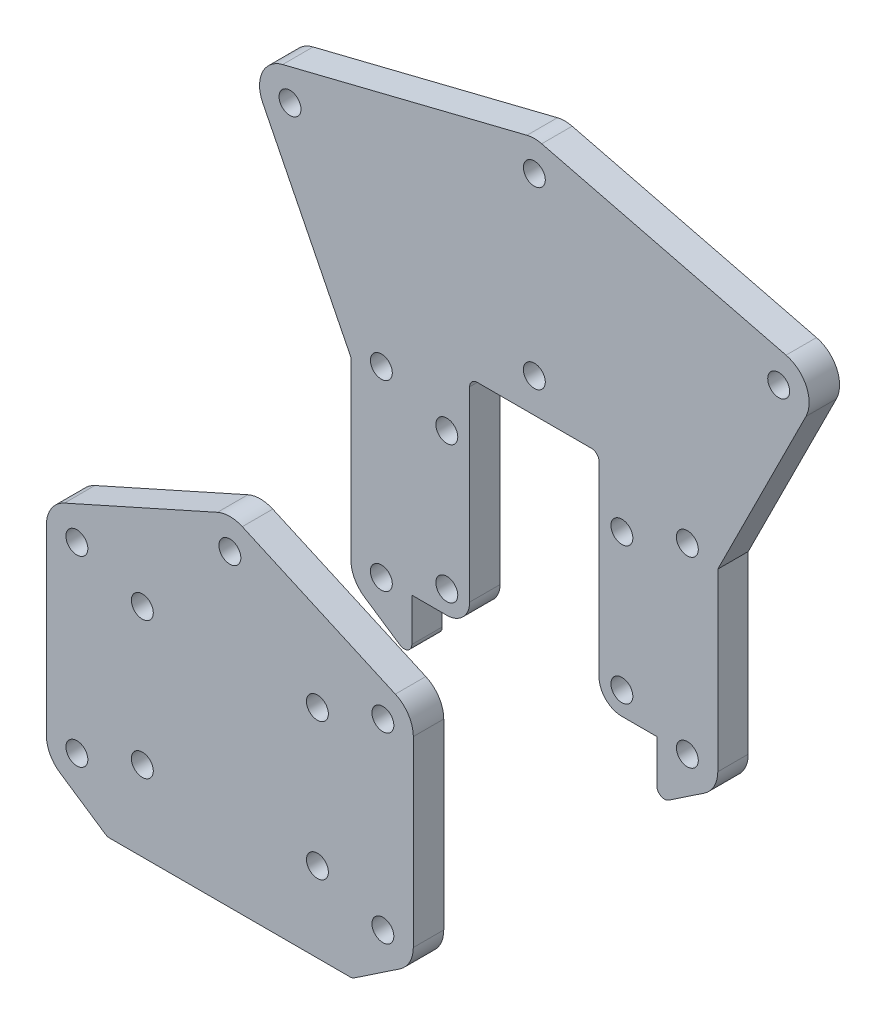
from build123d import *

# Parameters (mm, degrees)
SKETCH1_R               = 2.286
BOSS_EXTRUDE1_DEPTH     = 6.35
BOSS_EXTRUDE2_START     = -57.15
SKETCH1_3_R             = 2.286
BOSS_EXTRUDE2_DEPTH     = 6.35
FILLET1_R               = 1.5875
FILLET2_R               = 1.5875
CUT_EXTRUDE1_DEPTH      = 7.62
FILLET3_R               = 4.7625
CUT_EXTRUDE2_START      = -9.525
SKETCH4_R               = 2.286
CUT_EXTRUDE2_DEPTH      = 9.525
CUT_EXTRUDE3_DEPTH      = 119.193719489
CUT_EXTRUDE3_DEPTH_BACK = 119.193719489
SKETCH4_3_R             = 2.286


with BuildPart() as part:
    # Sketch1 → Boss-Extrude1 (new body)
    with BuildSketch(Plane.XY):
        with BuildLine():
            Line((-25.55875, -30.95625), (25.55875, -30.95625))
            Line((25.55875, -30.95625), (35.446293253, -24.323356401))
            ThreePointArc((35.446293253, -24.323356401), (37.511691176, -22.038235294), (38.25875, -19.05))
            Line((38.25875, -19.05), (38.25875, 17.550968343))
            Line((38.25875, 17.550968343), (56.638362663, 54.310193669))
            ThreePointArc((56.638362663, 54.310193669), (56.726833867, 59.805505319), (52.49433438, 63.311532327))
            Line((52.49433438, 63.311532327), (1.53558438, 76.011532327))
            ThreePointArc((1.53558438, 76.011532327), (0, 76.2), (-1.53558438, 76.011532327))
            Line((-1.53558438, 76.011532327), (-52.49433438, 63.311532327))
            ThreePointArc((-52.49433438, 63.311532327), (-56.726833867, 59.805505319), (-56.638362663, 54.310193669))
            Line((-56.638362663, 54.310193669), (-38.25875, 17.550968343))
            Line((-38.25875, 17.550968343), (-38.25875, -19.05))
            ThreePointArc((-38.25875, -19.05), (-37.511691176, -22.038235294), (-35.446293253, -24.323356401))
            Line((-35.446293253, -24.323356401), (-25.55875, -30.95625))
        make_face()
        with Locations((-31.90875, -19.05)):
            Circle(SKETCH1_R, mode=Mode.SUBTRACT)
        with Locations((-18.25625, -14.2875)):
            Circle(SKETCH1_R, mode=Mode.SUBTRACT)
        with Locations((18.25625, -14.2875)):
            Circle(SKETCH1_R, mode=Mode.SUBTRACT)
        with Locations((31.90875, -19.05)):
            Circle(SKETCH1_R, mode=Mode.SUBTRACT)
        with Locations((-31.90875, 19.05)):
            Circle(SKETCH1_R, mode=Mode.SUBTRACT)
        with Locations((-50.95875, 57.15)):
            Circle(SKETCH1_R, mode=Mode.SUBTRACT)
        with Locations((31.90875, 19.05)):
            Circle(SKETCH1_R, mode=Mode.SUBTRACT)
        with Locations((50.95875, 57.15)):
            Circle(SKETCH1_R, mode=Mode.SUBTRACT)
        with Locations((0, 69.85)):
            Circle(SKETCH1_R, mode=Mode.SUBTRACT)
    extrude(amount=BOSS_EXTRUDE1_DEPTH)

    # Fillet2
    fillet2_edges = [part.edges().sort_by_distance(p)[0] for p in [
        (25.55875, -30.95625, 3.175),
        (-25.55875, -30.95625, 3.175),
    ]]
    fillet(fillet2_edges, radius=FILLET2_R)

    # Sketch4 → Cut-Extrude2 (cut)
    # profile 1 of 3: a face of its own
    with BuildSketch(Plane.XY.offset(6.35).offset(CUT_EXTRUDE2_START)):
        with BuildLine():
            Line((-98.245897659, 9.07752692), (-38.25875, 17.550968343))
            Line((-38.25875, 17.550968343), (-56.638362663, 54.310193669))
            ThreePointArc((-56.638362663, 54.310193669), (-56.726833867, 59.805505319), (-52.49433438, 63.311532327))
            Line((-52.49433438, 63.311532327), (-1.53558438, 76.011532327))
            ThreePointArc((-1.53558438, 76.011532327), (0, 76.2), (1.53558438, 76.011532327))
            Line((1.53558438, 76.011532327), (52.49433438, 63.311532327))
            ThreePointArc((52.49433438, 63.311532327), (56.726833867, 59.805505319), (56.638362663, 54.310193669))
            Line((56.638362663, 54.310193669), (38.25875, 17.550968343))
            Line((38.25875, 17.550968343), (125.422392006, 90.402311249))
            Line((125.422392006, 90.402311249), (-79.231707288, 82.909223574))
            Line((-79.231707288, 82.909223574), (-98.245897659, 9.07752692))
        make_face()
    # profile 2 of 3: a face of its own
    with BuildSketch(Plane.XY.offset(6.35).offset(CUT_EXTRUDE2_START)):
        with Locations((0, 33.3375)):
            Circle(SKETCH4_R)
    # profile 3 of 3: a face of its own
    with BuildSketch(Plane.XY.offset(6.35).offset(CUT_EXTRUDE2_START)):
        with BuildLine():
            ThreePointArc((-38.25875, 19.05), (-37.237956498, 22.502833345), (-34.503771069, 24.845547054))
            Line((-34.503771069, 24.845547054), (-2.595021069, 39.133047054))
            ThreePointArc((-2.595021069, 39.133047054), (0, 39.6875), (2.595021069, 39.133047054))
            Line((2.595021069, 39.133047054), (34.503771069, 24.845547054))
            ThreePointArc((34.503771069, 24.845547054), (37.237956498, 22.502833345), (38.25875, 19.05))
            Line((38.25875, 19.05), (38.25875, 17.550968343))
            Line((38.25875, 17.550968343), (56.638362663, 54.310193669))
            ThreePointArc((56.638362663, 54.310193669), (56.726833867, 59.805505319), (52.49433438, 63.311532327))
            Line((52.49433438, 63.311532327), (1.53558438, 76.011532327))
            ThreePointArc((1.53558438, 76.011532327), (0, 76.2), (-1.53558438, 76.011532327))
            Line((-1.53558438, 76.011532327), (-52.49433438, 63.311532327))
            ThreePointArc((-52.49433438, 63.311532327), (-56.726833867, 59.805505319), (-56.638362663, 54.310193669))
            Line((-56.638362663, 54.310193669), (-38.25875, 17.550968343))
            Line((-38.25875, 17.550968343), (-38.25875, 19.05))
        make_face()
        with Locations(Location((-50.95875, 57.15, 0), (0, 0, 270))):
            Circle(SKETCH4_R, mode=Mode.SUBTRACT)
        with Locations(Location((0, 69.85, 0), (0, 0, 270))):
            Circle(SKETCH4_R, mode=Mode.SUBTRACT)
        with Locations(Location((50.95875, 57.15, 0), (0, 0, 270))):
            Circle(SKETCH4_R, mode=Mode.SUBTRACT)
    extrude(amount=CUT_EXTRUDE2_DEPTH, mode=Mode.SUBTRACT)


with BuildPart() as body_2:
    # Sketch1<3> → Boss-Extrude2 (new body)
    with BuildSketch(Plane.XY.offset(BOSS_EXTRUDE2_START)):
        with BuildLine():
            Line((-25.55875, -19.05), (25.55875, -19.05))
            Line((25.55875, -19.05), (25.55875, -30.95625))
            Line((25.55875, -30.95625), (35.446293253, -24.323356401))
            ThreePointArc((35.446293253, -24.323356401), (37.511691176, -22.038235294), (38.25875, -19.05))
            Line((38.25875, -19.05), (38.25875, 17.550968343))
            Line((38.25875, 17.550968343), (56.638362663, 54.310193669))
            ThreePointArc((56.638362663, 54.310193669), (56.726833867, 59.805505319), (52.49433438, 63.311532327))
            Line((52.49433438, 63.311532327), (1.53558438, 76.011532327))
            ThreePointArc((1.53558438, 76.011532327), (0, 76.2), (-1.53558438, 76.011532327))
            Line((-1.53558438, 76.011532327), (-52.49433438, 63.311532327))
            ThreePointArc((-52.49433438, 63.311532327), (-56.726833867, 59.805505319), (-56.638362663, 54.310193669))
            Line((-56.638362663, 54.310193669), (-38.25875, 17.550968343))
            Line((-38.25875, 17.550968343), (-38.25875, -19.05))
            ThreePointArc((-38.25875, -19.05), (-37.511691176, -22.038235294), (-35.446293253, -24.323356401))
            Line((-35.446293253, -24.323356401), (-25.55875, -30.95625))
            Line((-25.55875, -30.95625), (-25.55875, -19.05))
        make_face()
        with Locations(Location((-31.90875, -19.05, 0), (0, 0, 270))):
            Circle(SKETCH1_3_R, mode=Mode.SUBTRACT)
        with Locations(Location((-18.25625, -14.2875, 0), (0, 0, 270))):
            Circle(SKETCH1_3_R, mode=Mode.SUBTRACT)
        with Locations(Location((18.25625, -14.2875, 0), (0, 0, 270))):
            Circle(SKETCH1_3_R, mode=Mode.SUBTRACT)
        with Locations(Location((31.90875, -19.05, 0), (0, 0, 270))):
            Circle(SKETCH1_3_R, mode=Mode.SUBTRACT)
        with Locations(Location((-31.90875, 19.05, 0), (0, 0, 270))):
            Circle(SKETCH1_3_R, mode=Mode.SUBTRACT)
        with Locations(Location((-50.95875, 57.15, 0), (0, 0, 270))):
            Circle(SKETCH1_3_R, mode=Mode.SUBTRACT)
        with Locations(Location((31.90875, 19.05, 0), (0, 0, 270))):
            Circle(SKETCH1_3_R, mode=Mode.SUBTRACT)
        with Locations(Location((50.95875, 57.15, 0), (0, 0, 270))):
            Circle(SKETCH1_3_R, mode=Mode.SUBTRACT)
        with Locations(Location((0, 69.85, 0), (0, 0, 270))):
            Circle(SKETCH1_3_R, mode=Mode.SUBTRACT)
    extrude(amount=-BOSS_EXTRUDE2_DEPTH)

    # Fillet1
    fillet1_edges = [body_2.edges().sort_by_distance(p)[0] for p in [
        (-25.55875, -30.95625, -60.325),
        (25.55875, -30.95625, -60.325),
    ]]
    fillet(fillet1_edges, radius=FILLET1_R)

    # Sketch3 → Cut-Extrude1 (cut)
    with BuildSketch(Plane(origin=(0, 0, -63.5), x_dir=(-1, 0, 0), z_dir=(0, 0, -1))):
        with BuildLine():
            Line((11.90625, 26.19375), (-11.90625, 26.19375))
            ThreePointArc((-11.90625, 26.19375), (-13.028782015, 25.728782015), (-13.49375, 24.60625))
            Line((-13.49375, 24.60625), (-13.49375, -24.60625))
            ThreePointArc((-13.49375, -24.60625), (-13.028782015, -25.728782015), (-11.90625, -26.19375))
            Line((-11.90625, -26.19375), (11.90625, -26.19375))
            ThreePointArc((11.90625, -26.19375), (13.028782015, -25.728782015), (13.49375, -24.60625))
            Line((13.49375, -24.60625), (13.49375, 24.60625))
            ThreePointArc((13.49375, 24.60625), (13.028782015, 25.728782015), (11.90625, 26.19375))
        make_face()
    extrude(amount=-CUT_EXTRUDE1_DEPTH, mode=Mode.SUBTRACT)

    # Fillet3
    fillet3_edges = [body_2.edges().sort_by_distance(p)[0] for p in [
        (-13.49375, -19.05, -60.325),
        (13.49375, -19.05, -60.325),
    ]]
    fillet(fillet3_edges, radius=FILLET3_R)


with BuildPart() as cut_extrude3_tool:
    # Sketch4<3> → Cut-Extrude3 (new, two sides: drawn at the far end of the back side and taken through both)
    with BuildSketch(Plane.XY.offset(6.35).offset(-CUT_EXTRUDE3_DEPTH_BACK)):
        with Locations((0, 33.3375)):
            Circle(SKETCH4_3_R)
        with Locations((-18.25625, 14.2875)):
            Circle(SKETCH4_3_R)
        with Locations((18.25625, 14.2875)):
            Circle(SKETCH4_3_R)
    extrude(amount=CUT_EXTRUDE3_DEPTH + CUT_EXTRUDE3_DEPTH_BACK)


with BuildPart() as part_1:
    add(part.part)

    # Cut-Extrude3: cut by cut_extrude3_tool
    add(cut_extrude3_tool.part, mode=Mode.SUBTRACT)


with BuildPart() as body_2_1:
    add(body_2.part)

    # Cut-Extrude3: cut by cut_extrude3_tool
    add(cut_extrude3_tool.part, mode=Mode.SUBTRACT)


solid = Compound([part_1.part, body_2_1.part])
